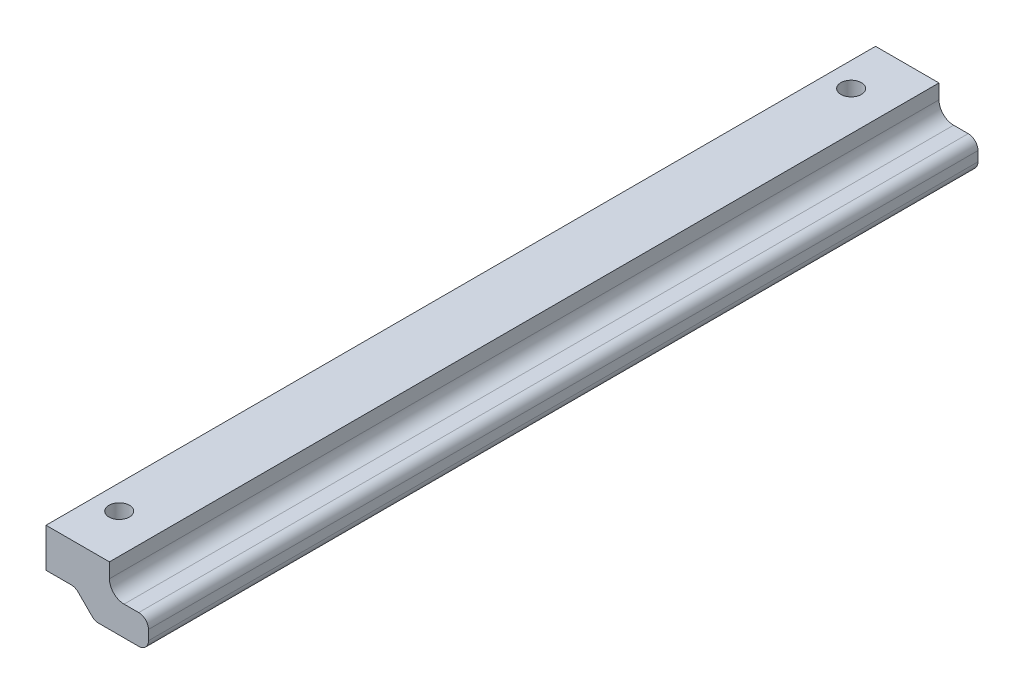
from build123d import *

# Parameters (mm, degrees)
BOSS_EXTRUDE1_DEPTH = 170
FILLET2_R           = 3
SKETCH2_R           = 2.1
CUT_EXTRUDE1_DEPTH  = 8
CUT_EXTRUDE2_START  = -12
CUT_EXTRUDE2_DEPTH  = 9
FILLET3_R           = 2
FILLET4_R           = 2


with BuildPart() as part:
    # Sketch1 → Boss-Extrude1 (new body)
    with BuildSketch(Plane.XY):
        Polygon((13, -6), (13, 0), (0, 0), (0, -8), (6, -8), (10, -12), (21, -12), (21, -6), align=None)
    extrude(amount=-BOSS_EXTRUDE1_DEPTH)

    # Fillet2
    fillet2_edges = [part.edges().sort_by_distance(p)[0] for p in [
        (13, -6, -85),
    ]]
    fillet(fillet2_edges, radius=FILLET2_R)

    # Sketch2 → Cut-Extrude1 (cut)
    with BuildSketch(Plane(origin=(0, 0, 0), x_dir=(1, 0, 0), z_dir=(0, 1, 0))):
        with Locations(Location((5, 10, 0), (0, 0, 270))):
            Circle(SKETCH2_R)
        with Locations(Location((5, 160, 0), (0, 0, 270))):
            Circle(SKETCH2_R)
    extrude(amount=-CUT_EXTRUDE1_DEPTH, mode=Mode.SUBTRACT)

    # Sketch3 → Cut-Extrude2 (cut)
    with BuildSketch(Plane(origin=(0, 0, 0), x_dir=(1, 0, 0), z_dir=(0, 1, 0)).offset(CUT_EXTRUDE2_START)):
        Polygon((1.55, 11.991858429), (1.55, 8.008141571), (5, 6.016283143), (8.45, 8.008141571), (8.45, 11.991858429), (5, 13.983716857), align=None)
        Polygon((1.55, 161.991858429), (1.55, 158.008141571), (5, 156.016283143), (8.45, 158.008141571), (8.45, 161.991858429), (5, 163.983716857), align=None)
    extrude(amount=CUT_EXTRUDE2_DEPTH, mode=Mode.SUBTRACT)

    # Fillet3
    fillet3_edges = [part.edges().sort_by_distance(p)[0] for p in [
        (21, -6, -85),
        (21, -12, -85),
    ]]
    fillet(fillet3_edges, radius=FILLET3_R)

    # Fillet4
    fillet4_edges = [part.edges().sort_by_distance(p)[0] for p in [
        (10, -12, -85),
        (6, -8, -166.703183294),
        (6, -8, -85),
        (6, -8, -3.296816706),
    ]]
    fillet(fillet4_edges, radius=FILLET4_R)


solid = part.part
